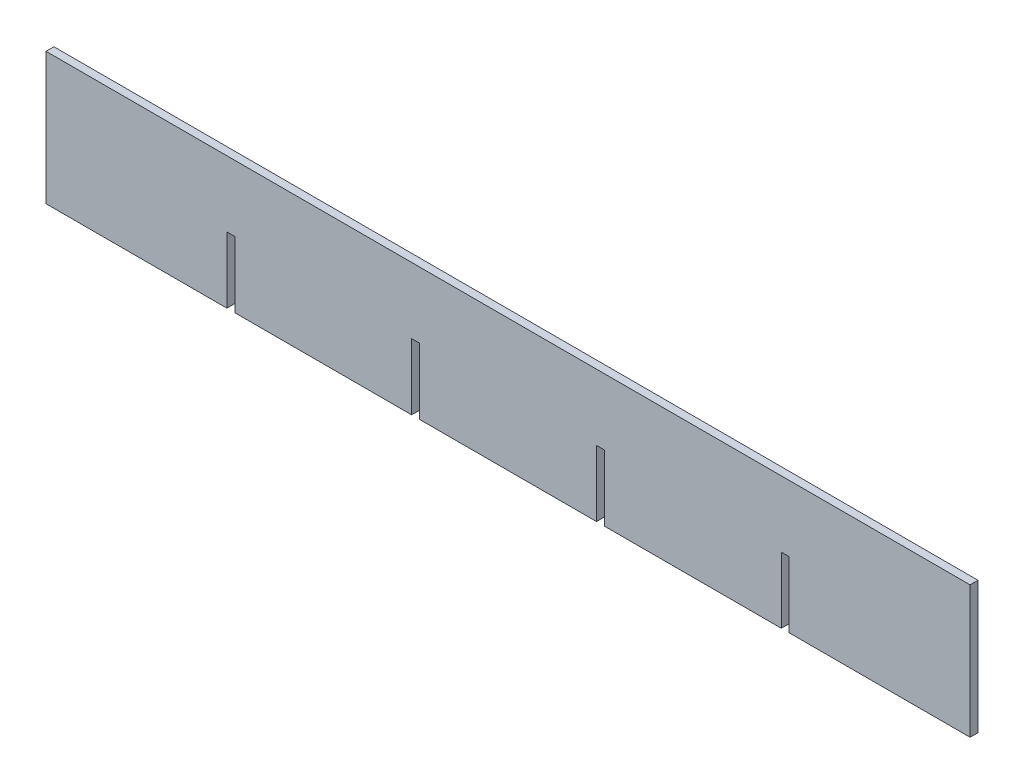
from build123d import *

# Parameters (mm, degrees)
BOSS_EXTRUDE3_DEPTH = 3


with BuildPart() as part:
    # Sketch1 → Boss-Extrude3 (new body)
    with BuildSketch(Plane.XY):
        Polygon((0, 50), (0, 0), (68.5, 0), (68.5, 25), (71.5, 25), (71.5, 0), (138.5, 0), (138.5, 25), (141.5, 25), (141.5, 0), (208.5, 0), (208.5, 25), (211.5, 25), (211.5, 0), (278.5, 0), (278.5, 25), (281.5, 25), (281.5, 0), (350, 0), (350, 50), align=None)
    extrude(amount=BOSS_EXTRUDE3_DEPTH)


solid = part.part
